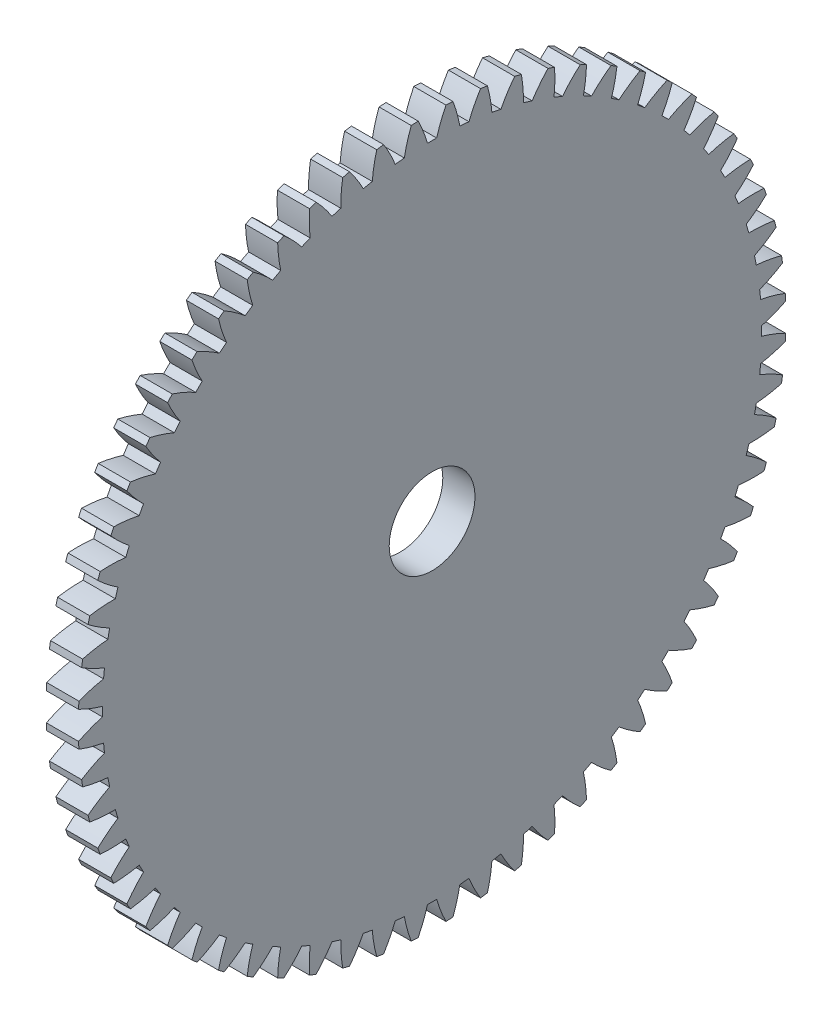
from build123d import *

# Parameters (mm, degrees)
BASPROSKE_W     = 3
BASPROSKE_H     = 33
TOOTHCUT_DEPTH  = 47.765371804
TEETHCUTS_COUNT = 64
BORSKE_R        = 4
BORE_DEPTH      = 50.0000508


with BuildPart() as part:
    # BasProSke → Base-Revolve (revolve)
    with BuildSketch(Plane(origin=(0, 0, 0), x_dir=(1, 0, 0), z_dir=(0, 1, 0)), mode=Mode.PRIVATE) as base_revolve_sk:
        with Locations((1.5, 16.5)):
            Rectangle(BASPROSKE_W, BASPROSKE_H)
    revolve(base_revolve_sk.sketch.rotate(Axis((-10, 0, 0), (1, 0, 0)), 180), axis=Axis((-10, 0, 0), (1, 0, 0)))

    # TooCutSke → ToothCut (cut, through all)
    with BuildSketch(Plane(origin=(0, 0, 0), x_dir=(0, 0, -1), z_dir=(1, 0, 0))):
        with BuildLine():
            ThreePointArc((0.427774964, 30.746024289), (0, 30.749), (-0.427774964, 30.746024289))
            ThreePointArc((-0.427774964, 30.746024289), (-0.81426693, 31.893595), (-1.307470481, 32.999508574))
            ThreePointArc((-1.307470481, 32.999508574), (0, 33.0254), (1.307470481, 32.999508574))
            ThreePointArc((1.307470481, 32.999508574), (0.81426693, 31.893595), (0.427774964, 30.746024289))
        make_face()
    toothcut = extrude(amount=TOOTHCUT_DEPTH, mode=Mode.SUBTRACT)

    # TeethCuts: ToothCut ×64 about axis
    teethcuts_axis = Axis((0, 0, 0), (1, 0, 0))
    for i in range(1, TEETHCUTS_COUNT):
        add(toothcut.rotate(teethcuts_axis, i * 360 / TEETHCUTS_COUNT), mode=Mode.SUBTRACT)

    # BorSke → Bore (cut, symmetric)
    with BuildSketch(Plane(origin=(0, 0, 0), x_dir=(0, 0, -1), z_dir=(1, 0, 0))):
        with Locations(Location((0, 0, 0), (0, 0, 180))):
            Circle(BORSKE_R)
    extrude(amount=BORE_DEPTH, both=True, mode=Mode.SUBTRACT)


solid = part.part
